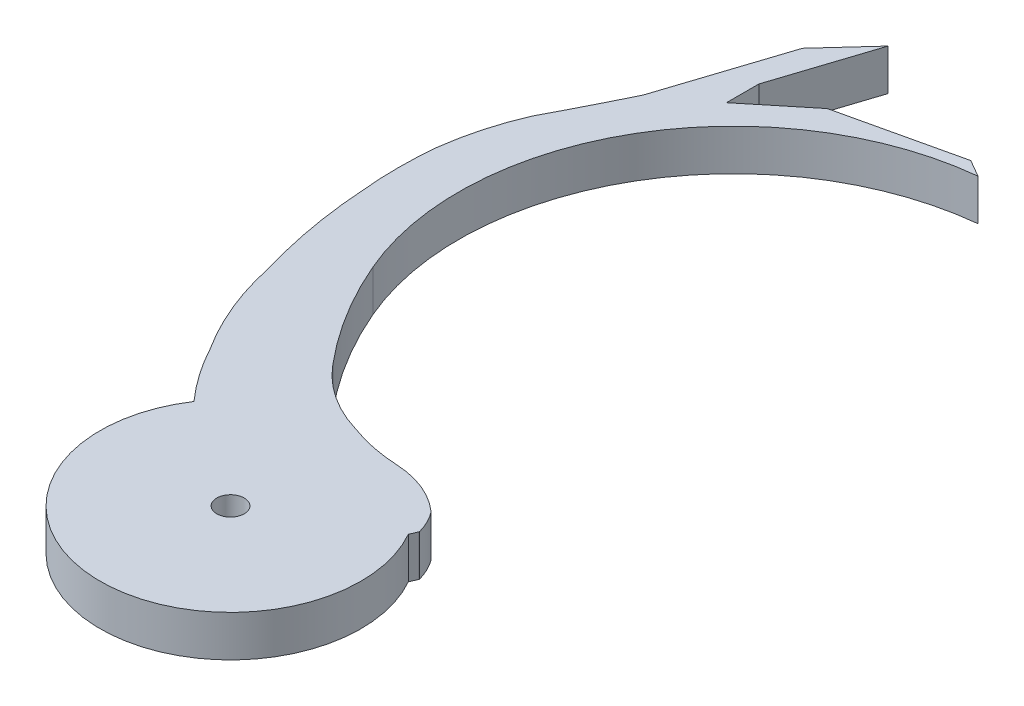
from build123d import *

# Parameters (mm, degrees)
SUNGU_KIRI_R        = 1
BOSS_EXTRUDE1_DEPTH = 3
SKETCH7_R           = 7.5
CUT_EXTRUDE2_DEPTH  = 0.5
SCALE1_SCALE        = 1.75


with BuildPart() as part:
    # sungu kiri → Boss-Extrude1 (new body)
    with BuildSketch(Plane(origin=(0, 0, 0), x_dir=(1, 0, 0), z_dir=(0, 1, 0))):
        with BuildLine():
            Line((-20.214241335, 18.58200887), (-17.903708636, 25.676772527))
            Line((-17.903708636, 25.676772527), (-20.879327355, 22.419581076))
            Line((-20.879327355, 22.419581076), (-23.726014444, 13.678492013))
            ThreePointArc((-23.726014444, 13.678492013), (-25.061399851, 10.98195956), (-26.444409257, 8.309539974))
            ThreePointArc((-26.444409257, 8.309539974), (-27.383764934, 5.63006722), (-27.936945566, 2.845115782))
            ThreePointArc((-27.936945566, 2.845115782), (-28.068014235, 0.18049064), (-27.936945566, -2.484134502))
            ThreePointArc((-27.936945566, -2.484134502), (-27.425713247, -6.715299694), (-26.444409257, -10.862727794))
            ThreePointArc((-26.444409257, -10.862727794), (-25.296755437, -14.61403578), (-23.488374839, -18.095297119))
            ThreePointArc((-23.488374839, -18.095297119), (-22.238356067, -20.131176806), (-20.758136978, -22.006357992))
            ThreePointArc((-20.758136978, -22.006357992), (-13.175246696, -36.755405871), (-4.582277955, -22.571064976))
            ThreePointArc((-4.582277955, -22.571064976), (-4.460378612, -22.299351604), (-4.344569641, -22.024987085))
            ThreePointArc((-4.344569641, -22.024987085), (-4.340995805, -22.01171692), (-4.3373846, -21.998456875))
            ThreePointArc((-4.3373846, -21.998456875), (-4.667057778, -21.129677391), (-5.155481579, -20.33916845))
            ThreePointArc((-5.155481579, -20.33916845), (-7.110923153, -19.117606911), (-9.361873626, -18.618421268))
            ThreePointArc((-9.361873626, -18.618421268), (-11.285784226, -18.376920372), (-13.150188878, -17.844238508))
            ThreePointArc((-13.150188878, -17.844238508), (-15.818147575, -16.60648921), (-18.010368345, -14.645827324))
            ThreePointArc((-18.010368345, -14.645827324), (-20.650416196, -11.005311906), (-22.72256926, -7.01414831))
            ThreePointArc((-22.72256926, -7.01414831), (-21.584958488, 10.98418111), (-6.423603233, 20.74980075))
            Line((-6.423603233, 20.74980075), (-7.667855794, 21.470443038))
            Line((-7.667855794, 21.470443038), (-16.17291449, 19.521519125))
            Line((-16.17291449, 19.521519125), (-20.214241335, 16.223172594))
            Line((-20.214241335, 16.223172594), (-20.214241335, 18.58200887))
        make_face()
        with Locations(Location((-12.843799059, -27.261189607, 0), (0, 0, 270))):
            Circle(SUNGU_KIRI_R, mode=Mode.SUBTRACT)
    extrude(amount=BOSS_EXTRUDE1_DEPTH)

    # Sketch7 → Cut-Extrude2 (cut)
    with BuildSketch(Plane(origin=(0, 0, 0), x_dir=(1, 0, 0), z_dir=(0, 1, 0))):
        with Locations(Location((-12.843799059, -27.261189607, 0), (0, 0, 270))):
            Circle(SKETCH7_R)
    extrude(amount=CUT_EXTRUDE2_DEPTH, mode=Mode.SUBTRACT)


with BuildPart() as part_1:
    # Scale1: scaled about (-17.083309672, 1.577817205, 15.178250086)
    add(part.part.scale(SCALE1_SCALE).moved(Location((12.812482254, -1.183362904, -11.383687565))))


solid = part_1.part
